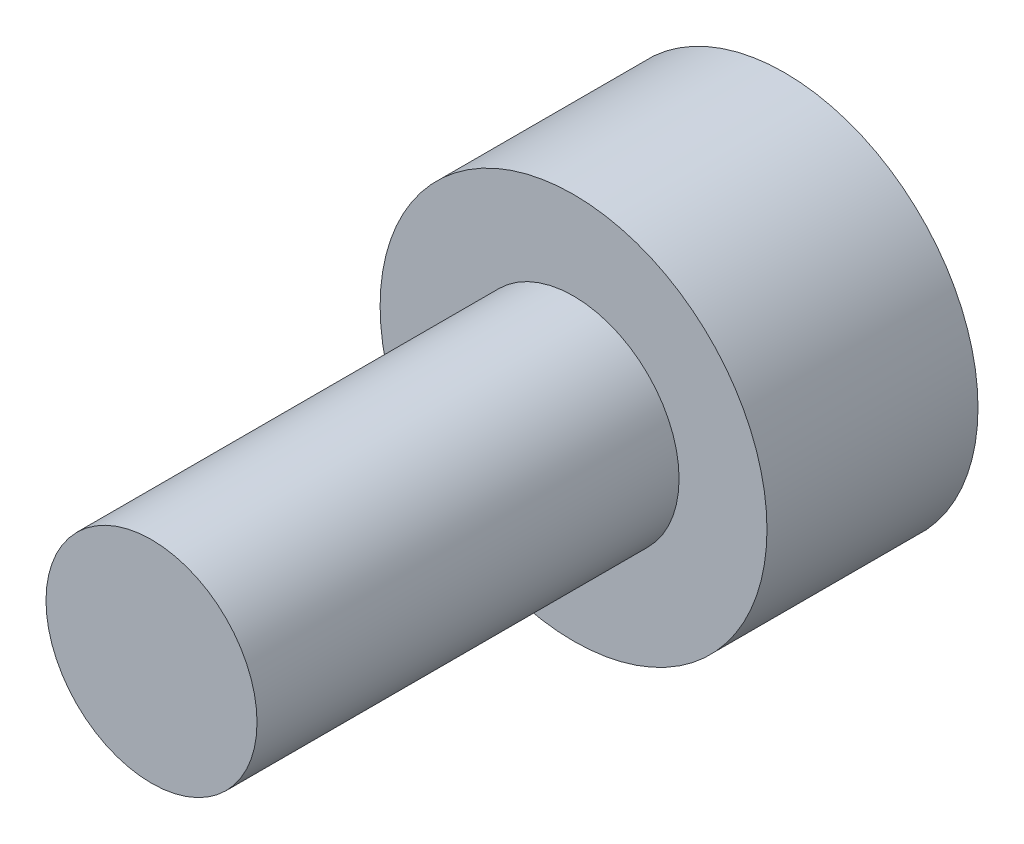
from build123d import *

# Parameters (mm, degrees)
SKETCH1_R           = 2.75
BOSS_EXTRUDE1_DEPTH = 3
SKETCH1_3_R         = 1.5
BOSS_EXTRUDE2_DEPTH = 6


with BuildPart() as part:
    # Sketch1 → Boss-Extrude1 (new body)
    with BuildSketch(Plane.XY):
        Circle(SKETCH1_R)
    extrude(amount=-BOSS_EXTRUDE1_DEPTH)

    # Sketch1<3> → Boss-Extrude2 (add)
    with BuildSketch(Plane.XY):
        Circle(SKETCH1_3_R)
    extrude(amount=BOSS_EXTRUDE2_DEPTH)


solid = part.part
